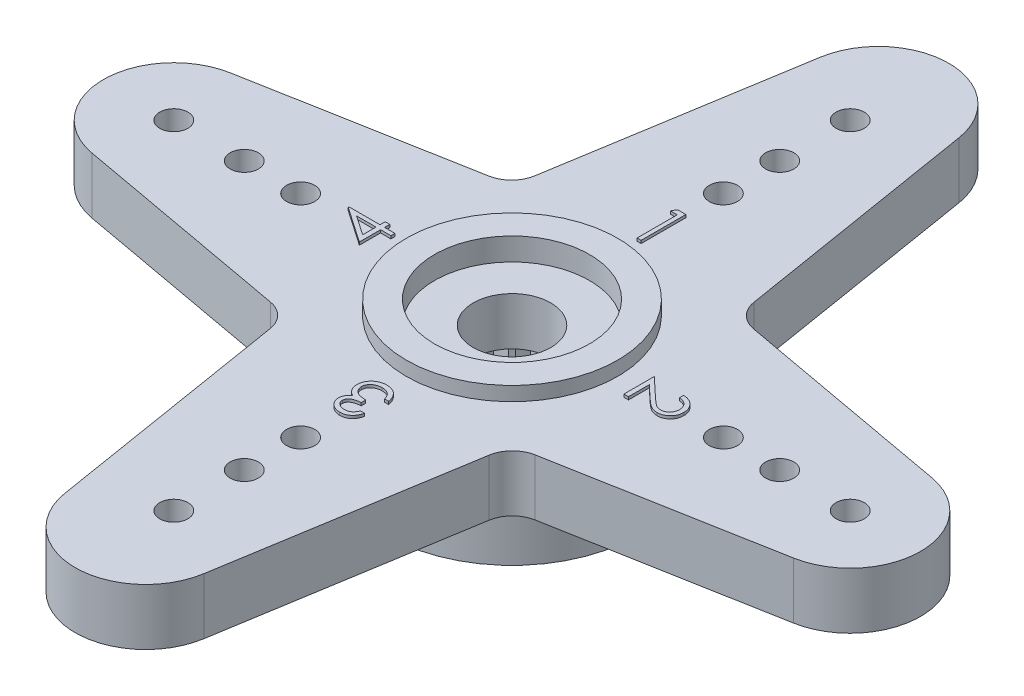
from build123d import *

# Parameters (mm, degrees)
SKETCH1_R           = 0.5
SKETCH1_R_2         = 1.375
BOSS_EXTRUDE1_DEPTH = 2
SKETCH2_R           = 3.75
SKETCH2_R_2         = 2.75
BOSS_EXTRUDE2_DEPTH = 0.5
CUT_EXTRUDE1_START  = -0.8
SKETCH3_R           = 2.75
SKETCH3_R_2         = 1.375
CUT_EXTRUDE1_DEPTH  = 0.8
SKETCH4_R           = 4.5
SKETCH4_R_2         = 2.5
BOSS_EXTRUDE3_DEPTH = 2.5
CUT_EXTRUDE3_START  = -2.5
CUT_EXTRUDE3_DEPTH  = 2.5
BOSS_EXTRUDE4_DEPTH = 0.1
FILLET1_R           = 1


with BuildPart() as part:
    # Sketch1 → Boss-Extrude1 (new body)
    with BuildSketch(Plane(origin=(0, 0, 0), x_dir=(1, 0, 0), z_dir=(0, 1, 0))):
        with BuildLine():
            Line((-4, 4), (-2.467435953, 13.402193757))
            ThreePointArc((-2.467435953, 13.402193757), (0, 15.5), (2.467435953, 13.402193757))
            Line((2.467435953, 13.402193757), (4, 4))
            Line((4, 4), (12.448472752, 2.459445505))
            ThreePointArc((12.448472752, 2.459445505), (14.5, 0), (12.448472752, -2.459445505))
            Line((12.448472752, -2.459445505), (4, -4))
            Line((4, -4), (2.467435953, -13.402193757))
            ThreePointArc((2.467435953, -13.402193757), (0, -15.5), (-2.467435953, -13.402193757))
            Line((-2.467435953, -13.402193757), (-4, -4))
            Line((-4, -4), (-12.448472752, -2.459445505))
            ThreePointArc((-12.448472752, -2.459445505), (-14.5, 0), (-12.448472752, 2.459445505))
            Line((-12.448472752, 2.459445505), (-4, 4))
        make_face()
        with Locations(Location((0, 12, 0), (0, 0, 270))):
            Circle(SKETCH1_R, mode=Mode.SUBTRACT)
        with Locations(Location((0, 9.5, 0), (0, 0, 270))):
            Circle(SKETCH1_R, mode=Mode.SUBTRACT)
        with Locations(Location((0, 7.5, 0), (0, 0, 270))):
            Circle(SKETCH1_R, mode=Mode.SUBTRACT)
        with Locations(Location((12, 0, 0), (0, 0, 270))):
            Circle(SKETCH1_R, mode=Mode.SUBTRACT)
        with Locations(Location((9.5, 0, 0), (0, 0, 270))):
            Circle(SKETCH1_R, mode=Mode.SUBTRACT)
        with Locations(Location((7.5, 0, 0), (0, 0, 270))):
            Circle(SKETCH1_R, mode=Mode.SUBTRACT)
        with Locations(Location((0, -12, 0), (0, 0, 270))):
            Circle(SKETCH1_R, mode=Mode.SUBTRACT)
        with Locations(Location((0, -9.5, 0), (0, 0, 270))):
            Circle(SKETCH1_R, mode=Mode.SUBTRACT)
        with Locations(Location((0, -7.5, 0), (0, 0, 270))):
            Circle(SKETCH1_R, mode=Mode.SUBTRACT)
        with Locations(Location((-12, 0, 0), (0, 0, 270))):
            Circle(SKETCH1_R, mode=Mode.SUBTRACT)
        with Locations(Location((-9.5, 0, 0), (0, 0, 270))):
            Circle(SKETCH1_R, mode=Mode.SUBTRACT)
        with Locations(Location((-7.5, 0, 0), (0, 0, 270))):
            Circle(SKETCH1_R, mode=Mode.SUBTRACT)
        with Locations(Location((0, 0, 0), (0, 0, 270))):
            Circle(SKETCH1_R_2, mode=Mode.SUBTRACT)
    extrude(amount=BOSS_EXTRUDE1_DEPTH)

    # Sketch2 → Boss-Extrude2 (add)
    with BuildSketch(Plane(origin=(0, 2, 0), x_dir=(1, 0, 0), z_dir=(0, 1, 0))):
        with Locations(Location((0, 0, 0), (0, 0, 270))):
            Circle(SKETCH2_R)
        with Locations(Location((0, 0, 0), (0, 0, 270))):
            Circle(SKETCH2_R_2, mode=Mode.SUBTRACT)
    extrude(amount=BOSS_EXTRUDE2_DEPTH)

    # Sketch3 → Cut-Extrude1 (cut)
    with BuildSketch(Plane(origin=(0, 2.5, 0), x_dir=(1, 0, 0), z_dir=(0, 1, 0)).offset(CUT_EXTRUDE1_START)):
        with Locations(Location((0, 0, 0), (0, 0, 270))):
            Circle(SKETCH3_R)
        with Locations(Location((0, 0, 0), (0, 0, 270))):
            Circle(SKETCH3_R_2, mode=Mode.SUBTRACT)
    extrude(amount=CUT_EXTRUDE1_DEPTH, mode=Mode.SUBTRACT)

    # Sketch4 → Boss-Extrude3 (add)
    with BuildSketch(Plane.XZ):
        with Locations(Location((0, 0, 0), (0, 0, 90))):
            Circle(SKETCH4_R)
        with Locations(Location((0, 0, 0), (0, 0, 270))):
            Circle(SKETCH4_R_2, mode=Mode.SUBTRACT)
    extrude(amount=BOSS_EXTRUDE3_DEPTH)

    # Sketch5 → Cut-Extrude3 (cut)
    with BuildSketch(Plane.XZ.offset(2.5).offset(CUT_EXTRUDE3_START)):
        with BuildLine():
            Line((0.299038106, 2.482050808), (0, 3))
            Line((0, 3), (-0.299038106, 2.482050808))
            ThreePointArc((-0.299038106, 2.482050808), (-0.391086163, 2.469220851), (-0.482593741, 2.452978451))
            Line((-0.482593741, 2.452978451), (-0.927050983, 2.853169549))
            Line((-0.927050983, 2.853169549), (-1.051398019, 2.268162738))
            ThreePointArc((-1.051398019, 2.268162738), (-1.134976249, 2.22751631), (-1.216985951, 2.183791473))
            Line((-1.216985951, 2.183791473), (-1.763355757, 2.427050983))
            Line((-1.763355757, 2.427050983), (-1.70083977, 1.832251096))
            ThreePointArc((-1.70083977, 1.832251096), (-1.767766953, 1.767766953), (-1.832251096, 1.70083977))
            Line((-1.832251096, 1.70083977), (-2.427050983, 1.763355757))
            Line((-2.427050983, 1.763355757), (-2.183791473, 1.216985951))
            ThreePointArc((-2.183791473, 1.216985951), (-2.22751631, 1.134976249), (-2.268162738, 1.051398019))
            Line((-2.268162738, 1.051398019), (-2.853169549, 0.927050983))
            Line((-2.853169549, 0.927050983), (-2.452978451, 0.482593741))
            ThreePointArc((-2.452978451, 0.482593741), (-2.469220851, 0.391086163), (-2.482050808, 0.299038106))
            Line((-2.482050808, 0.299038106), (-3, 0))
            Line((-3, 0), (-2.482050808, -0.299038106))
            ThreePointArc((-2.482050808, -0.299038106), (-2.469220851, -0.391086163), (-2.452978451, -0.482593741))
            Line((-2.452978451, -0.482593741), (-2.853169549, -0.927050983))
            Line((-2.853169549, -0.927050983), (-2.268162738, -1.051398019))
            ThreePointArc((-2.268162738, -1.051398019), (-2.22751631, -1.134976249), (-2.183791473, -1.216985951))
            Line((-2.183791473, -1.216985951), (-2.427050983, -1.763355757))
            Line((-2.427050983, -1.763355757), (-1.832251096, -1.70083977))
            ThreePointArc((-1.832251096, -1.70083977), (-1.767766953, -1.767766953), (-1.70083977, -1.832251096))
            Line((-1.70083977, -1.832251096), (-1.763355757, -2.427050983))
            Line((-1.763355757, -2.427050983), (-1.216985951, -2.183791473))
            ThreePointArc((-1.216985951, -2.183791473), (-1.134976249, -2.22751631), (-1.051398019, -2.268162738))
            Line((-1.051398019, -2.268162738), (-0.927050983, -2.853169549))
            Line((-0.927050983, -2.853169549), (-0.482593741, -2.452978451))
            ThreePointArc((-0.482593741, -2.452978451), (-0.391086163, -2.469220851), (-0.299038106, -2.482050808))
            Line((-0.299038106, -2.482050808), (0, -3))
            Line((0, -3), (0.299038106, -2.482050808))
            ThreePointArc((0.299038106, -2.482050808), (0.391086163, -2.469220851), (0.482593741, -2.452978451))
            Line((0.482593741, -2.452978451), (0.927050983, -2.853169549))
            Line((0.927050983, -2.853169549), (1.051398019, -2.268162738))
            ThreePointArc((1.051398019, -2.268162738), (1.134976249, -2.22751631), (1.216985951, -2.183791473))
            Line((1.216985951, -2.183791473), (1.763355757, -2.427050983))
            Line((1.763355757, -2.427050983), (1.70083977, -1.832251096))
            ThreePointArc((1.70083977, -1.832251096), (1.767766953, -1.767766953), (1.832251096, -1.70083977))
            Line((1.832251096, -1.70083977), (2.427050983, -1.763355757))
            Line((2.427050983, -1.763355757), (2.183791473, -1.216985951))
            ThreePointArc((2.183791473, -1.216985951), (2.22751631, -1.134976249), (2.268162738, -1.051398019))
            Line((2.268162738, -1.051398019), (2.853169549, -0.927050983))
            Line((2.853169549, -0.927050983), (2.452978451, -0.482593741))
            ThreePointArc((2.452978451, -0.482593741), (2.469220851, -0.391086163), (2.482050808, -0.299038106))
            Line((2.482050808, -0.299038106), (3, 0))
            Line((3, 0), (2.482050808, 0.299038106))
            ThreePointArc((2.482050808, 0.299038106), (2.469220851, 0.391086163), (2.452978451, 0.482593741))
            Line((2.452978451, 0.482593741), (2.853169549, 0.927050983))
            Line((2.853169549, 0.927050983), (2.268162738, 1.051398019))
            ThreePointArc((2.268162738, 1.051398019), (2.22751631, 1.134976249), (2.183791473, 1.216985951))
            Line((2.183791473, 1.216985951), (2.427050983, 1.763355757))
            Line((2.427050983, 1.763355757), (1.832251096, 1.70083977))
            ThreePointArc((1.832251096, 1.70083977), (1.767766953, 1.767766953), (1.70083977, 1.832251096))
            Line((1.70083977, 1.832251096), (1.763355757, 2.427050983))
            Line((1.763355757, 2.427050983), (1.216985951, 2.183791473))
            ThreePointArc((1.216985951, 2.183791473), (1.134976249, 2.22751631), (1.051398019, 2.268162738))
            Line((1.051398019, 2.268162738), (0.927050983, 2.853169549))
            Line((0.927050983, 2.853169549), (0.482593741, 2.452978451))
            ThreePointArc((0.482593741, 2.452978451), (0.391086163, 2.469220851), (0.299038106, 2.482050808))
        make_face()
    extrude(amount=CUT_EXTRUDE3_DEPTH, mode=Mode.SUBTRACT)

    # Sketch6 → Boss-Extrude4 (add)
    # profile 1 of 4: a face of its own
    with BuildSketch(Plane(origin=(0, 2, 0), x_dir=(1, 0, 0), z_dir=(0, 1, 0))):
        Polygon((-0.212111879, 6.0875), (0.081410256, 6.0875), (0.081410256, 4.5), (-0.061057692, 4.5), (-0.061057692, 5.924679487), (-0.305288462, 5.924679487), align=None)
    # profile 2 of 4: a face of its own
    with BuildSketch(Plane(origin=(0, 2, 0), x_dir=(1, 0, 0), z_dir=(0, 1, 0))):
        with BuildLine():
            Line((5.599038462, 0.34599359), (5.599038462, 0.488461538))
            add(Edge.make_bspline(
                [(5.599038462, 0.488461538), (5.617939279, 0.487533166), (5.655059981, 0.485709868), (5.709180577, 0.477167658), (5.760917347, 0.46495614), (5.809826741, 0.447649569), (5.856493025, 0.426277468), (5.900296523, 0.40011183), (5.941671981, 0.369710466), (5.979836023, 0.335129148), (6.014722729, 0.29760523), (6.045167992, 0.25736354), (6.070596953, 0.214817686), (6.091970581, 0.170336692), (6.107994605, 0.123406123), (6.119889389, 0.074474582), (6.127044708, 0.023320904), (6.12781392, -0.011531495), (6.128205128, -0.029256811)],
                knots=[0, 0, 0, 0, 1.100776268, 2.161895295, 3.184016182, 4.190939212, 5.176500551, 6.166955529, 7.155448256, 8.160289653, 9.16017456, 10.133824356, 11.091467644, 12.04088621, 13.000931625, 13.972173743, 14.968683325, 16, 16, 16, 16], degree=3))
            add(Edge.make_bspline(
                [(6.128205128, -0.029256811), (6.127797614, -0.046664009), (6.126996863, -0.080868531), (6.120120254, -0.130789516), (6.109349932, -0.178313503), (6.094239011, -0.223347597), (6.073926074, -0.265532491), (6.049525047, -0.305185086), (6.02130391, -0.342777454), (5.988078073, -0.376616959), (5.952607706, -0.407690267), (5.914739978, -0.434497361), (5.875628838, -0.457454046), (5.834976046, -0.476589172), (5.79239883, -0.490675349), (5.748517063, -0.501369751), (5.702876523, -0.507414685), (5.671985336, -0.50834243), (5.656280048, -0.508814103)],
                knots=[0, 0, 0, 0, 1.111607364, 2.184268762, 3.212621178, 4.221274766, 5.211760367, 6.196651075, 7.1921475, 8.207485113, 9.220403448, 10.201281604, 11.166441695, 12.114753415, 13.065576456, 14.026450734, 14.996634279, 16, 16, 16, 16], degree=3))
            add(Edge.make_bspline(
                [(5.656280048, -0.508814103), (5.634169423, -0.508046087), (5.590336183, -0.506523533), (5.525922299, -0.493499512), (5.463513856, -0.473158416), (5.413286579, -0.448666758), (5.372812816, -0.423959614), (5.339489511, -0.401694923), (5.30360953, -0.375630526), (5.265293024, -0.345387065), (5.224239863, -0.311590155), (5.180474849, -0.273933674), (5.134450153, -0.232149094), (5.103015113, -0.202821846), (5.086726262, -0.1876252)],
                knots=[0, 0, 0, 0, 1.184426356, 2.348067706, 3.509069118, 4.696110526, 5.333549288, 6.050745305, 6.844228056, 7.710549037, 8.667450064, 9.695053472, 10.805634456, 12, 12, 12, 12], degree=3))
            Line((5.086726262, -0.1876252), (4.662820513, 0.209567808))
            Line((4.662820513, 0.209567808), (4.662820513, -0.529166667))
            Line((4.662820513, -0.529166667), (4.5, -0.529166667))
            Line((4.5, -0.529166667), (4.5, 0.549519231))
            Line((4.5, 0.549519231), (5.15700621, -0.066145833))
            add(Edge.make_bspline(
                [(5.15700621, -0.066145833), (5.172652803, -0.081136472), (5.202706705, -0.10993042), (5.246597776, -0.15063927), (5.287268318, -0.187261175), (5.324898551, -0.219820431), (5.359275147, -0.248343825), (5.390667508, -0.272740096), (5.418806234, -0.293117072), (5.451862432, -0.31471242), (5.492269991, -0.335305017), (5.541401752, -0.353403803), (5.592090897, -0.364360562), (5.626334746, -0.36568164), (5.643559696, -0.366346154)],
                knots=[0, 0, 0, 0, 1.329530082, 2.553755191, 3.672934919, 4.687409497, 5.60679272, 6.413407421, 7.126401618, 7.737995624, 8.834647426, 9.90044882, 10.943907757, 12, 12, 12, 12], degree=3))
            add(Edge.make_bspline(
                [(5.643559696, -0.366346154), (5.654392812, -0.366060761), (5.675742806, -0.365498307), (5.707024672, -0.360440353), (5.737316681, -0.353009214), (5.766244292, -0.341555532), (5.794376458, -0.327794356), (5.820857871, -0.310213439), (5.846591221, -0.290123068), (5.87069413, -0.266819222), (5.892776139, -0.241235929), (5.912335573, -0.214204803), (5.928681993, -0.185607306), (5.94208205, -0.155562618), (5.952593749, -0.124154868), (5.959877459, -0.091323211), (5.964450586, -0.057158391), (5.965069336, -0.033829626), (5.965384615, -0.021942608)],
                knots=[0, 0, 0, 0, 0.991504627, 1.954065223, 2.895985987, 3.842598665, 4.797835564, 5.759220273, 6.74786863, 7.784730864, 8.824135544, 9.839918996, 10.835834653, 11.835434876, 12.84861661, 13.863796685, 14.911511676, 16, 16, 16, 16], degree=3))
            add(Edge.make_bspline(
                [(5.965384615, -0.021942608), (5.965060395, -0.009527925), (5.964423681, 0.014852462), (5.959967009, 0.050647099), (5.952285925, 0.084797422), (5.941755322, 0.117372561), (5.928497209, 0.148403903), (5.911665037, 0.177610862), (5.891915995, 0.205260088), (5.869403165, 0.231300798), (5.844219896, 0.255228126), (5.816492727, 0.276692883), (5.786041295, 0.295000051), (5.753553406, 0.311228532), (5.718165248, 0.323645722), (5.680734357, 0.334259816), (5.64072893, 0.341970171), (5.613166096, 0.344630175), (5.599038462, 0.34599359)],
                knots=[0, 0, 0, 0, 1.031212865, 2.025131798, 2.990757446, 3.934781266, 4.865570067, 5.788494791, 6.729227313, 7.684356718, 8.643577152, 9.610526866, 10.590658432, 11.59095419, 12.621640561, 13.700587263, 14.82141059, 16, 16, 16, 16], degree=3))
        make_face()
    # profile 3 of 4: a face of its own
    with BuildSketch(Plane(origin=(0, 2, 0), x_dir=(1, 0, 0), z_dir=(0, 1, 0))):
        with BuildLine():
            Line((0.34599359, -5.721153846), (0.488461538, -5.721153846))
            add(Edge.make_bspline(
                [(0.488461538, -5.721153846), (0.484601849, -5.737134294), (0.477056473, -5.768374763), (0.461318645, -5.813009485), (0.444173983, -5.855247654), (0.423586782, -5.894298373), (0.401131025, -5.930946447), (0.37540322, -5.964360657), (0.347590345, -5.995390823), (0.316826886, -6.022928613), (0.284564958, -6.04786494), (0.250349969, -6.069126127), (0.2148703, -6.08741601), (0.177880129, -6.102483759), (0.139269329, -6.113834621), (0.099386965, -6.122070029), (0.05812852, -6.127418142), (0.030121577, -6.127940095), (0.015900441, -6.128205128)],
                knots=[0, 0, 0, 0, 1.162005537, 2.271625781, 3.343758855, 4.383309926, 5.390229558, 6.379919256, 7.361854164, 8.333198761, 9.295911338, 10.242430842, 11.177959212, 12.116337295, 13.062827104, 14.020064771, 14.994644689, 16, 16, 16, 16], degree=3))
            add(Edge.make_bspline(
                [(0.015900441, -6.128205128), (-0.004819946, -6.127579549), (-0.045808747, -6.126342036), (-0.106026272, -6.115041559), (-0.164095579, -6.097159445), (-0.21938106, -6.072451719), (-0.270733706, -6.041977474), (-0.316424762, -6.005707754), (-0.355834908, -5.964342356), (-0.388897715, -5.918652943), (-0.414785304, -5.86982348), (-0.43387448, -5.819567694), (-0.445495743, -5.7680048), (-0.447001853, -5.733189891), (-0.44775641, -5.715747696)],
                knots=[0, 0, 0, 0, 1.083050992, 2.142477498, 3.193116406, 4.255571735, 5.30263384, 6.308962982, 7.297363603, 8.282367274, 9.249857812, 10.179914175, 11.08814088, 12, 12, 12, 12], degree=3))
            add(Edge.make_bspline(
                [(-0.44775641, -5.715747696), (-0.447228639, -5.698962472), (-0.446195871, -5.666116392), (-0.437426655, -5.618164141), (-0.422669136, -5.572969558), (-0.402226779, -5.530342388), (-0.375764719, -5.490552907), (-0.343709603, -5.453511592), (-0.305835181, -5.419054153), (-0.277133663, -5.399314963), (-0.262357272, -5.389152644)],
                knots=[0, 0, 0, 0, 1.024540389, 2.004866551, 2.965041327, 3.920577974, 4.882998113, 5.874504559, 6.905732034, 8, 8, 8, 8], degree=3))
            add(Edge.make_bspline(
                [(-0.262357272, -5.389152644), (-0.279266057, -5.38102782), (-0.312821544, -5.364904106), (-0.358097689, -5.332780608), (-0.399825574, -5.296601576), (-0.422822908, -5.268052723), (-0.43440004, -5.253680889)],
                knots=[0, 0, 0, 0, 1.015663554, 2.015584519, 3.001021554, 4, 4, 4, 4], degree=3))
            add(Edge.make_bspline(
                [(-0.43440004, -5.253680889), (-0.442041901, -5.243223667), (-0.457200483, -5.222480465), (-0.475858316, -5.189110161), (-0.492978135, -5.155480456), (-0.505577827, -5.120269074), (-0.516450862, -5.084607067), (-0.523604956, -5.047730768), (-0.528197599, -5.009990535), (-0.5288425, -4.984446887), (-0.529166667, -4.971607071)],
                knots=[0, 0, 0, 0, 1.02516404, 2.033540309, 3.025129118, 4.011046665, 4.991655828, 5.976607087, 6.982917762, 8, 8, 8, 8], degree=3))
            add(Edge.make_bspline(
                [(-0.529166667, -4.971607071), (-0.528350817, -4.94937866), (-0.526722958, -4.905026444), (-0.512235463, -4.839481871), (-0.489636803, -4.775530087), (-0.458141824, -4.71407805), (-0.418998333, -4.656756936), (-0.372686258, -4.605322495), (-0.319156288, -4.561514187), (-0.259966982, -4.524586511), (-0.195593193, -4.495321744), (-0.127013944, -4.474234108), (-0.05463527, -4.461584484), (-0.005138768, -4.460066765), (0.020034555, -4.459294872)],
                knots=[0, 0, 0, 0, 0.955619592, 1.906742024, 2.874954321, 3.868585453, 4.869520953, 5.854611167, 6.836527075, 7.836578462, 8.849204403, 9.870874567, 10.917152508, 12, 12, 12, 12], degree=3))
            add(Edge.make_bspline(
                [(0.020034555, -4.459294872), (0.037005812, -4.459692103), (0.070399587, -4.460473722), (0.11951096, -4.465721886), (0.166290723, -4.475567824), (0.211193125, -4.487950453), (0.253540479, -4.505070826), (0.293941914, -4.525481482), (0.332220335, -4.549705826), (0.36814842, -4.577784596), (0.401687783, -4.60921458), (0.431983954, -4.644517919), (0.459372127, -4.683035728), (0.48367828, -4.725114484), (0.50500471, -4.770636328), (0.52289247, -4.819783675), (0.538510693, -4.872175513), (0.545786309, -4.908676289), (0.549519231, -4.927403846)],
                knots=[0, 0, 0, 0, 1.048603596, 2.063302207, 3.045874044, 3.999447474, 4.937100059, 5.862643889, 6.7929026, 7.7308982, 8.676022965, 9.627908155, 10.600123445, 11.591992905, 12.626222643, 13.701663232, 14.820785756, 16, 16, 16, 16], degree=3))
            Line((0.549519231, -4.927403846), (0.407051282, -4.927403846))
            add(Edge.make_bspline(
                [(0.407051282, -4.927403846), (0.403339575, -4.915180544), (0.396119982, -4.891405159), (0.383830783, -4.857187592), (0.369829816, -4.825819475), (0.354809999, -4.797070701), (0.339035489, -4.770658147), (0.321384791, -4.747280228), (0.303165214, -4.725910119), (0.289431365, -4.713870241), (0.282709836, -4.707977764)],
                knots=[0, 0, 0, 0, 1.198163088, 2.33053128, 3.407730985, 4.417276592, 5.372219308, 6.28897303, 7.162600585, 8, 8, 8, 8], degree=3))
            add(Edge.make_bspline(
                [(0.282709836, -4.707977764), (0.273820396, -4.701127882), (0.256068955, -4.68744926), (0.227160407, -4.669943613), (0.196651098, -4.654959198), (0.164286602, -4.642779237), (0.130062577, -4.63363652), (0.094117851, -4.627056022), (0.056393446, -4.622711871), (0.030647277, -4.622317113), (0.017490485, -4.622115385)],
                knots=[0, 0, 0, 0, 0.946083416, 1.889246487, 2.84504177, 3.809995578, 4.801312957, 5.829064617, 6.89060985, 8, 8, 8, 8], degree=3))
            add(Edge.make_bspline(
                [(0.017490485, -4.622115385), (0.002634231, -4.622394287), (-0.026415892, -4.622939657), (-0.068801536, -4.627969629), (-0.109137453, -4.635263244), (-0.147012014, -4.646671877), (-0.182940598, -4.660358417), (-0.216121178, -4.678276609), (-0.247529219, -4.69851231), (-0.276244612, -4.722050322), (-0.302132943, -4.747492366), (-0.324503322, -4.774484107), (-0.343878628, -4.802188626), (-0.35945314, -4.831252213), (-0.371773311, -4.861389777), (-0.380155306, -4.892714125), (-0.385984774, -4.924961484), (-0.386459435, -4.946882168), (-0.386698718, -4.957932692)],
                knots=[0, 0, 0, 0, 1.216990249, 2.379719373, 3.493992396, 4.571561497, 5.616923107, 6.638958652, 7.655775068, 8.674704564, 9.676001865, 10.625896028, 11.54399481, 12.441854662, 13.322657739, 14.20572845, 15.095482574, 16, 16, 16, 16], degree=3))
            add(Edge.make_bspline(
                [(-0.386698718, -4.957932692), (-0.386003169, -4.972723335), (-0.384615531, -5.002231023), (-0.374065118, -5.0456597), (-0.356555994, -5.087519235), (-0.332520572, -5.127261442), (-0.302560837, -5.163663871), (-0.268092983, -5.196247969), (-0.228381575, -5.223379244), (-0.191624295, -5.242072337), (-0.158981256, -5.254526807), (-0.131102444, -5.263260269), (-0.099863368, -5.270241472), (-0.06563939, -5.276994458), (-0.028286064, -5.282655717), (0.012230232, -5.287397248), (0.055925805, -5.291185256), (0.086174952, -5.292877803), (0.101762821, -5.29375)],
                knots=[0, 0, 0, 0, 1.070440979, 2.135555593, 3.216243406, 4.345886539, 5.486149072, 6.621334998, 7.769144672, 8.957074012, 9.598644492, 10.297969361, 11.070758978, 11.915404831, 12.824182859, 13.805940418, 14.869366021, 16, 16, 16, 16], degree=3))
            Line((0.101762821, -5.29375), (0.101762821, -5.456570513))
            add(Edge.make_bspline(
                [(0.101762821, -5.456570513), (0.082130288, -5.456953283), (0.043688426, -5.457702772), (-0.012623157, -5.464900992), (-0.066305692, -5.47658472), (-0.116551716, -5.492896722), (-0.162112282, -5.512755295), (-0.202016873, -5.53498931), (-0.234829912, -5.560639777), (-0.261139083, -5.588494162), (-0.280652882, -5.618558339), (-0.295056815, -5.64975068), (-0.303576438, -5.682651469), (-0.304715777, -5.70510004), (-0.305288462, -5.716383714)],
                knots=[0, 0, 0, 0, 1.321816535, 2.58820849, 3.816448615, 5.017641336, 6.139869627, 7.160068286, 8.085608132, 8.934319198, 9.728416342, 10.48890201, 11.240453369, 12, 12, 12, 12], degree=3))
            add(Edge.make_bspline(
                [(-0.305288462, -5.716383714), (-0.305104632, -5.724675376), (-0.304738912, -5.741171245), (-0.299942506, -5.765346601), (-0.293068021, -5.788783239), (-0.283080788, -5.811207319), (-0.270164259, -5.832690124), (-0.254537181, -5.853310117), (-0.236159971, -5.8732642), (-0.215151965, -5.892112288), (-0.191706493, -5.9090759), (-0.166764563, -5.924198724), (-0.140228938, -5.936914866), (-0.112272542, -5.947455684), (-0.082744259, -5.95537096), (-0.051799429, -5.961057912), (-0.019374439, -5.964612556), (0.002746995, -5.965124413), (0.013992388, -5.965384615)],
                knots=[0, 0, 0, 0, 0.884246871, 1.759167212, 2.622361933, 3.489113179, 4.372562419, 5.294145153, 6.247651513, 7.265905295, 8.30305477, 9.334068495, 10.37719476, 11.441246459, 12.52060732, 13.637552802, 14.799054011, 16, 16, 16, 16], degree=3))
            add(Edge.make_bspline(
                [(0.013992388, -5.965384615), (0.032068563, -5.964754757), (0.067375538, -5.963524498), (0.118264696, -5.952711076), (0.16552422, -5.935578323), (0.201526445, -5.914890575), (0.228156868, -5.894539373), (0.24755157, -5.877031234), (0.266250048, -5.85718059), (0.283518559, -5.83444296), (0.300391868, -5.809600201), (0.31670886, -5.782515486), (0.331945433, -5.752802669), (0.341220184, -5.73190776), (0.34599359, -5.721153846)],
                knots=[0, 0, 0, 0, 1.4727372, 2.876598283, 4.222346151, 5.558423782, 6.24313385, 6.953189256, 7.68715613, 8.463578749, 9.278833271, 10.135787152, 11.040551781, 12, 12, 12, 12], degree=3))
        make_face()
    # profile 4 of 4: a face of its own
    with BuildSketch(Plane(origin=(0, 2, 0), x_dir=(1, 0, 0), z_dir=(0, 1, 0))):
        Polygon((-6.128205128, 0.317054788), (-6.128205128, 0.34599359), (-5.029166667, 0.34599359), (-5.029166667, 0.529166667), (-4.866346154, 0.529166667), (-4.866346154, 0.34599359), (-4.5, 0.34599359), (-4.5, 0.203525641), (-4.866346154, 0.203525641), (-4.866346154, -0.549519231), align=None)
        Polygon((-5.029166667, 0.203525641), (-5.718609776, 0.203525641), (-5.029166667, -0.269671474), align=None, mode=Mode.SUBTRACT)
    extrude(amount=BOSS_EXTRUDE4_DEPTH)

    # Fillet1
    fillet1_edges = [part.edges().sort_by_distance(p)[0] for p in [
        (-4, 1, -4),
        (4, 1, -4),
        (4, 1, 4),
        (-4, 1, 4),
    ]]
    fillet(fillet1_edges, radius=FILLET1_R)


solid = part.part
